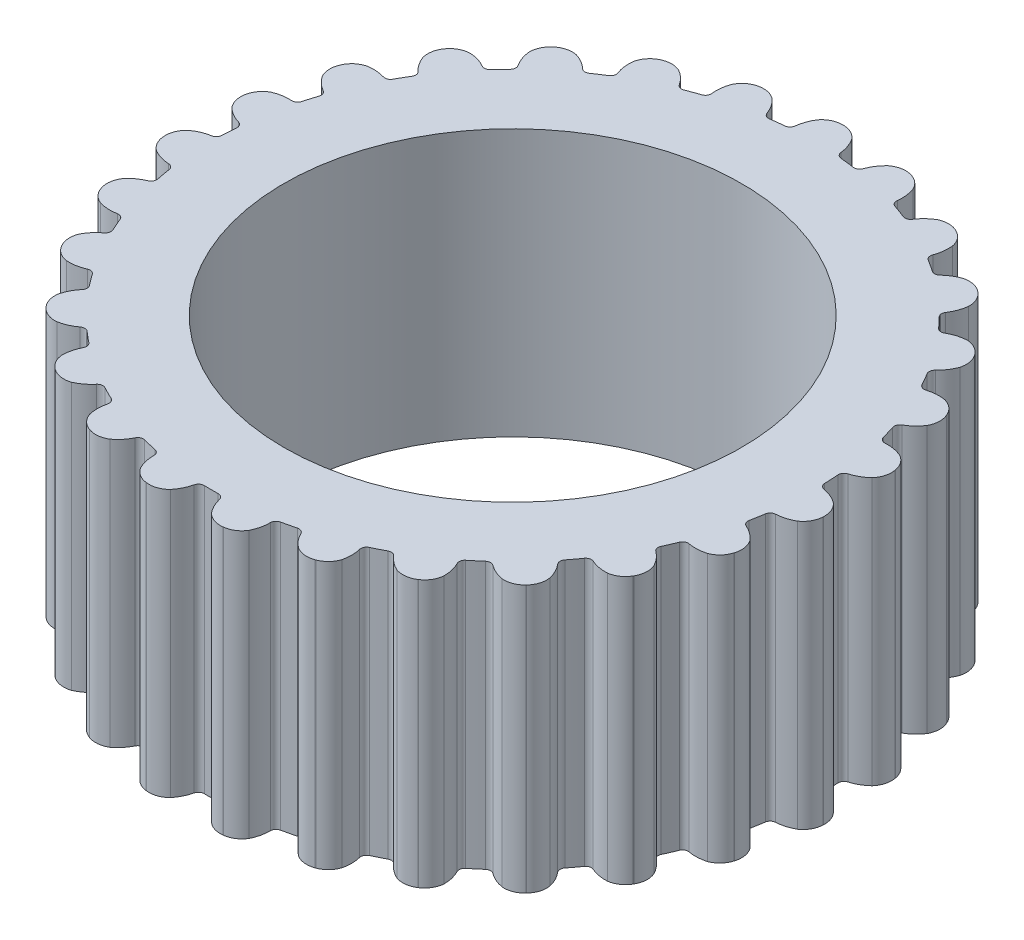
from build123d import *

# Parameters (mm, degrees)
BODYS_W             = 2.66
BODYS_H             = 7
GT2PROFILE_DEPTH    = 3.5
GT2_GROOVE_CP_COUNT = 27


with BuildPart() as part:
    # BodyS → Body (revolve)
    with BuildSketch(Plane.XY, mode=Mode.PRIVATE) as body_sk:
        with Locations((7.33, 0)):
            Rectangle(BODYS_W, BODYS_H)
    revolve(body_sk.sketch.rotate(Axis((0, 3.5, 0), (0, -1, 0)), 90), axis=Axis((0, 3.5, 0), (0, -1, 0)))

    # GT2ProfileS → GT2Profile (cut, symmetric)
    with BuildSketch(Plane(origin=(0, 0, 0), x_dir=(1, 0, 0), z_dir=(0, 1, 0))):
        with BuildLine():
            ThreePointArc((0.332629655, -8.024369196), (0.278534392, -7.9394651), (0.182943354, -7.90788415))
            ThreePointArc((0.182943354, -7.90788415), (0, -7.91), (-0.182943354, -7.90788415))
            ThreePointArc((-0.182943354, -7.90788415), (-0.278534392, -7.9394651), (-0.332629655, -8.024369196))
            ThreePointArc((-0.332629655, -8.024369196), (-0.411067749, -8.244566016), (-0.538481254, -8.440537884))
            ThreePointArc((-0.538481254, -8.440537884), (-0.749438431, -8.574495944), (-0.997779129, -8.602327407))
            ThreePointArc((-0.997779129, -8.602327407), (0, -8.66), (0.997779129, -8.602327407))
            ThreePointArc((0.997779129, -8.602327407), (0.749438431, -8.574495944), (0.538481254, -8.440537884))
            ThreePointArc((0.538481254, -8.440537884), (0.411067749, -8.244566016), (0.332629655, -8.024369196))
        make_face()
    gt2profile = extrude(amount=GT2PROFILE_DEPTH, both=True, mode=Mode.SUBTRACT)

    # GT2 Groove CP: GT2Profile ×27 about axis
    gt2_groove_cp_axis = Axis((0, 0, 0), (0, 1, 0))
    for i in range(1, GT2_GROOVE_CP_COUNT):
        add(gt2profile.rotate(gt2_groove_cp_axis, i * 360 / GT2_GROOVE_CP_COUNT), mode=Mode.SUBTRACT)


solid = part.part
